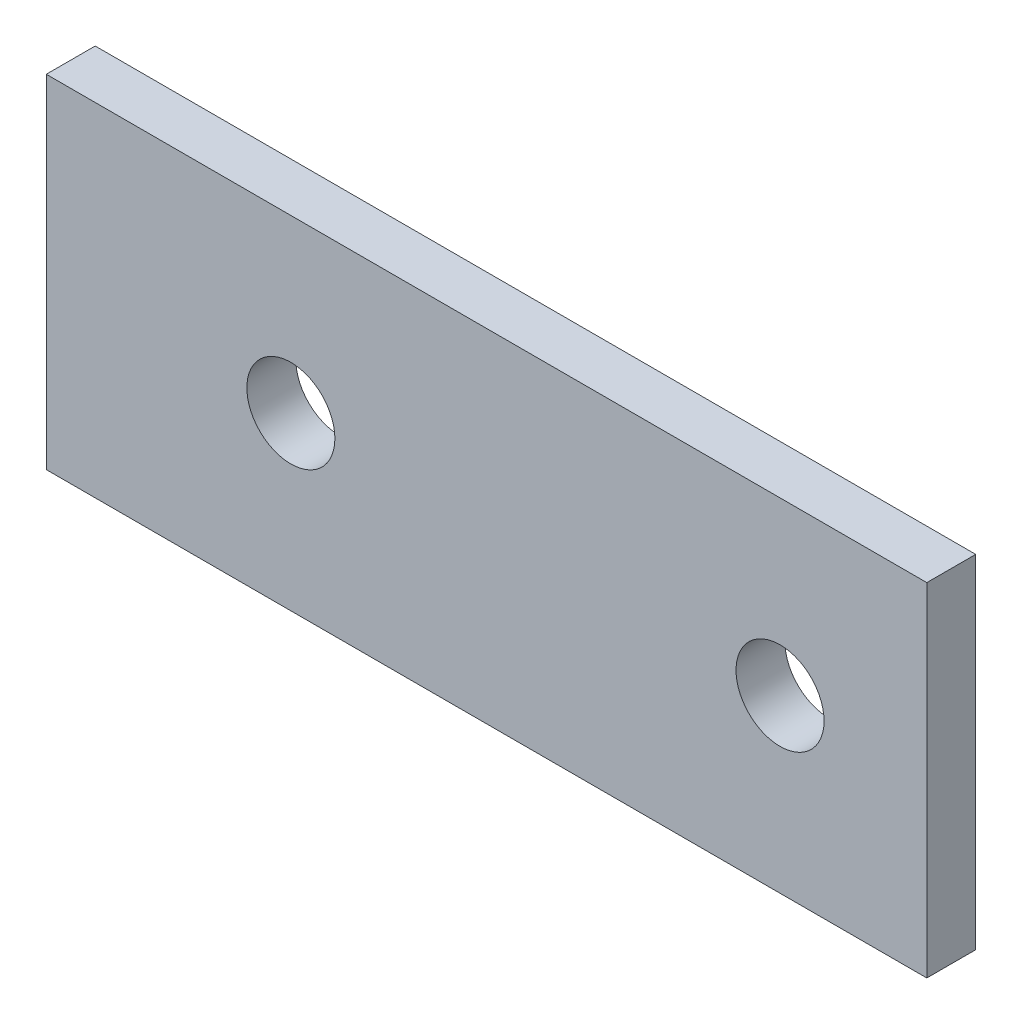
from build123d import *

# Parameters (mm, degrees)
SKETCH1_W           = 180
SKETCH1_H           = 70
SKETCH1_R           = 9
BOSS_EXTRUDE1_DEPTH = 5


with BuildPart() as part:
    # Sketch1 → Boss-Extrude1 (new, symmetric)
    with BuildSketch(Plane.XY):
        Rectangle(SKETCH1_W, SKETCH1_H)
        with Locations((60, 0)):
            Circle(SKETCH1_R, mode=Mode.SUBTRACT)
        with Locations((-40, 0)):
            Circle(SKETCH1_R, mode=Mode.SUBTRACT)
    extrude(amount=BOSS_EXTRUDE1_DEPTH, both=True)


solid = part.part
